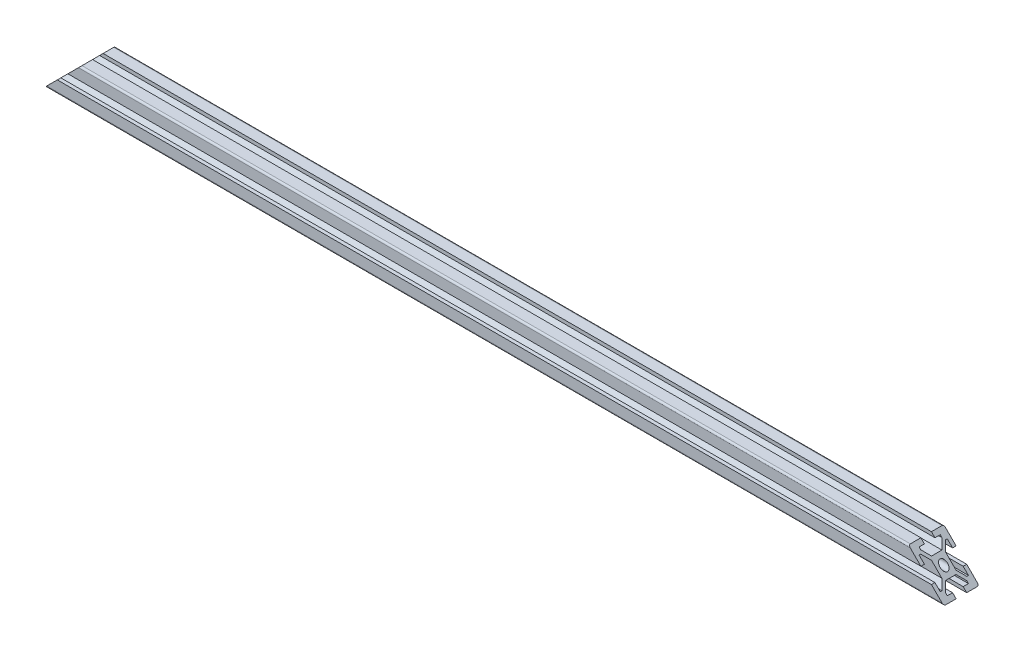
from build123d import *

# Parameters (mm, degrees)
SKETCH1_R           = 2.1
BOSS_EXTRUDE1_DEPTH = 510
CUT_EXTRUDE5_DEPTH  = 10
CUT_EXTRUDE6_DEPTH  = 10


with BuildPart() as part:
    # Sketch1 → Boss-Extrude1 (new body)
    with BuildSketch(Plane(origin=(0, 0, 0), x_dir=(0, 0, -1), z_dir=(1, 0, 0))):
        with BuildLine():
            Line((-10, 9), (-10, 3))
            Line((-10, 3), (-8, 3))
            Line((-8, 3), (-8, 6))
            Line((-8, 6), (-7.060660172, 6))
            Line((-7.060660172, 6), (-4, 2.939339828))
            Line((-4, 2.939339828), (-4, -2.939339828))
            Line((-4, -2.939339828), (-7.060660172, -6))
            Line((-7.060660172, -6), (-8, -6))
            Line((-8, -6), (-8, -3))
            Line((-8, -3), (-10, -3))
            Line((-10, -3), (-10, -9))
            ThreePointArc((-10, -9), (-9.707106781, -9.707106781), (-9, -10))
            Line((-9, -10), (-3, -10))
            Line((-3, -10), (-3, -8))
            Line((-3, -8), (-6, -8))
            Line((-6, -8), (-6, -7.060660172))
            Line((-6, -7.060660172), (-2.939339828, -4))
            Line((-2.939339828, -4), (2.939339828, -4))
            Line((2.939339828, -4), (6, -7.060660172))
            Line((6, -7.060660172), (6, -8))
            Line((6, -8), (3, -8))
            Line((3, -8), (3, -10))
            Line((3, -10), (9, -10))
            ThreePointArc((9, -10), (9.707106781, -9.707106781), (10, -9))
            Line((10, -9), (10, -3))
            Line((10, -3), (8, -3))
            Line((8, -3), (8, -6))
            Line((8, -6), (7.060660172, -6))
            Line((7.060660172, -6), (4, -2.939339828))
            Line((4, -2.939339828), (4, 2.939339828))
            Line((4, 2.939339828), (7.060660172, 6))
            Line((7.060660172, 6), (8, 6))
            Line((8, 6), (8, 3))
            Line((8, 3), (10, 3))
            Line((10, 3), (10, 9))
            ThreePointArc((10, 9), (9.707106781, 9.707106781), (9, 10))
            Line((9, 10), (3, 10))
            Line((3, 10), (3, 8))
            Line((3, 8), (6, 8))
            Line((6, 8), (6, 7.060660172))
            Line((6, 7.060660172), (2.939339828, 4))
            Line((2.939339828, 4), (-2.939339828, 4))
            Line((-2.939339828, 4), (-6, 7.060660172))
            Line((-6, 7.060660172), (-6, 8))
            Line((-6, 8), (-3, 8))
            Line((-3, 8), (-3, 10))
            Line((-3, 10), (-9, 10))
            ThreePointArc((-9, 10), (-9.707106781, 9.707106781), (-10, 9))
        make_face()
        Circle(SKETCH1_R, mode=Mode.SUBTRACT)
    extrude(amount=BOSS_EXTRUDE1_DEPTH)

    # Sketch32 → Cut-Extrude5 (cut, symmetric)
    with BuildSketch(Plane.XY):
        Polygon((0, 10), (20, 10), (0, -10), align=None)
    extrude(amount=CUT_EXTRUDE5_DEPTH, both=True, mode=Mode.SUBTRACT)

    # Sketch33 → Cut-Extrude6 (cut, symmetric)
    with BuildSketch(Plane.XY):
        Polygon((490, 10), (510, 10), (510, -10), align=None)
    extrude(amount=CUT_EXTRUDE6_DEPTH, both=True, mode=Mode.SUBTRACT)


solid = part.part
